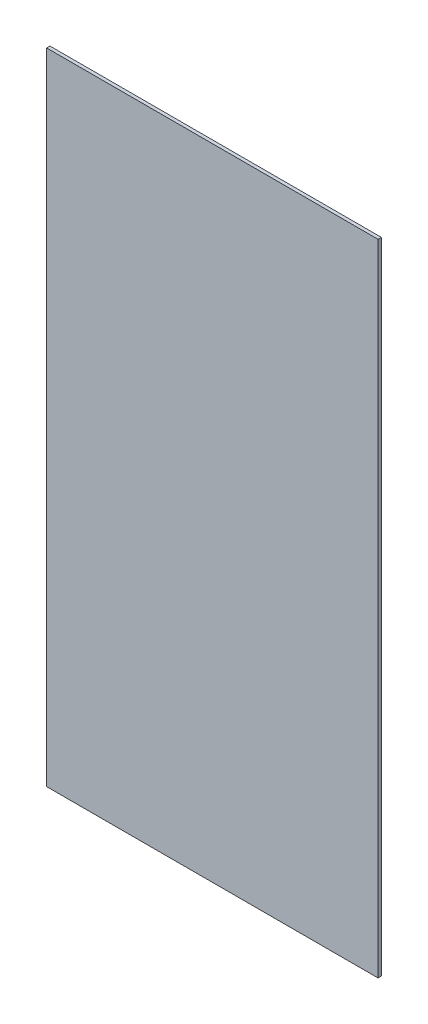
from build123d import *

# Parameters (mm, degrees)
SKETCH1_W           = 300
SKETCH1_H           = 579
BOSS_EXTRUDE1_DEPTH = 1.5


with BuildPart() as part:
    # Sketch1 → Boss-Extrude1 (new, symmetric)
    with BuildSketch(Plane.XY):
        Rectangle(SKETCH1_W, SKETCH1_H)
    extrude(amount=BOSS_EXTRUDE1_DEPTH, both=True)


solid = part.part
